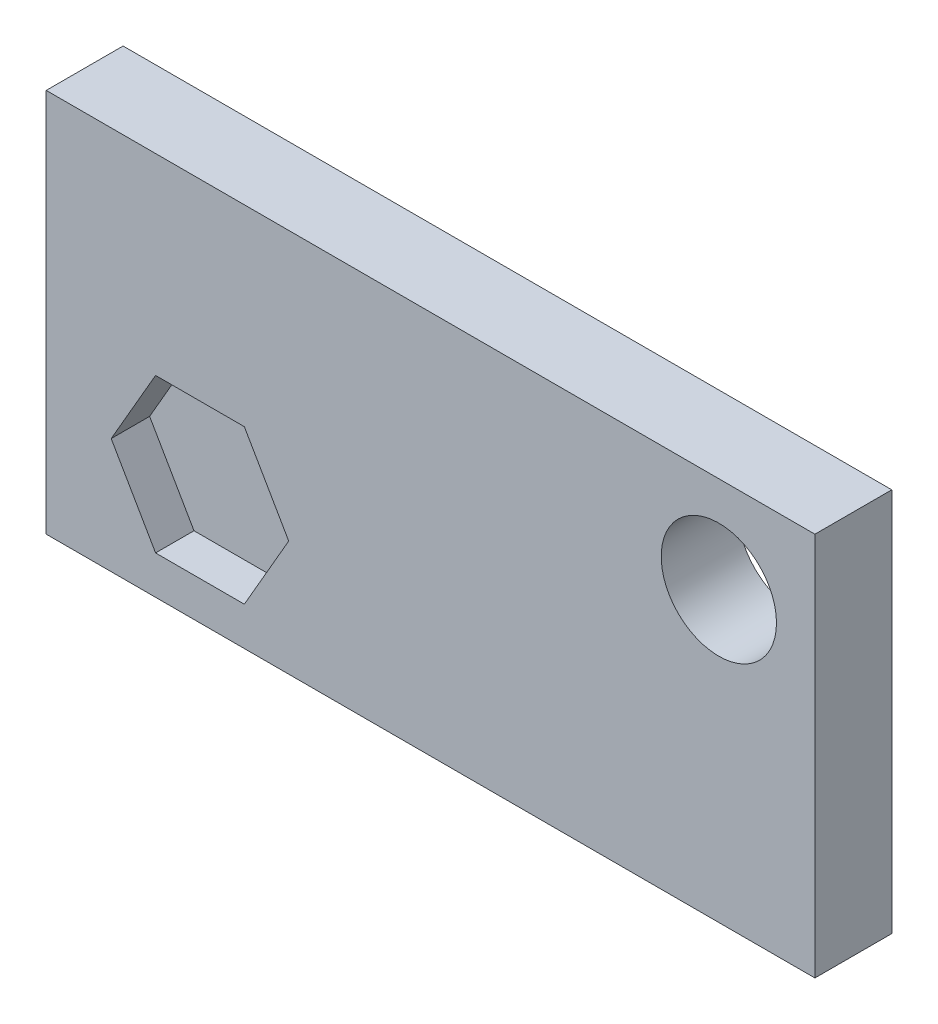
from build123d import *

# Parameters (mm, degrees)
SKETCH1_W           = 100
SKETCH1_H           = 50
SKETCH1_R           = 7.5
BOSS_EXTRUDE1_DEPTH = 10
CUT_EXTRUDE1_DEPTH  = 5


with BuildPart() as part:
    # Sketch1 → Boss-Extrude1 (new body)
    with BuildSketch(Plane.XY):
        with Locations((50, 25)):
            Rectangle(SKETCH1_W, SKETCH1_H)
        with Locations((87.5, 37.5)):
            Circle(SKETCH1_R, mode=Mode.SUBTRACT)
    extrude(amount=BOSS_EXTRUDE1_DEPTH)

    # Sketch2 → Cut-Extrude1 (cut)
    with BuildSketch(Plane.XY.offset(10)):
        Polygon((25.773502692, 25), (14.226497308, 25), (8.452994616, 15), (14.226497308, 5), (25.773502692, 5), (31.547005384, 15), align=None)
    extrude(amount=-CUT_EXTRUDE1_DEPTH, mode=Mode.SUBTRACT)


solid = part.part
